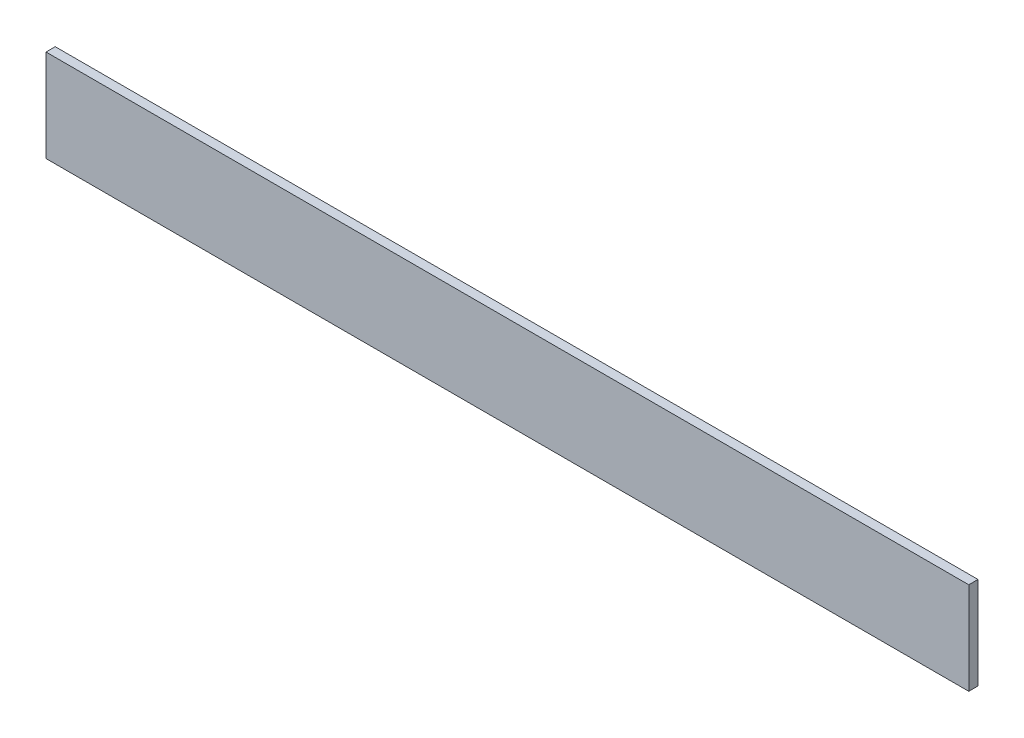
from build123d import *

# Parameters (mm, degrees)
SKETCH1_W           = 500
SKETCH1_H           = 50
BOSS_EXTRUDE1_DEPTH = 5


with BuildPart() as part:
    # Sketch1 → Boss-Extrude1 (new body)
    with BuildSketch(Plane.XY):
        with Locations((51.816239316, 30.822649573)):
            Rectangle(SKETCH1_W, SKETCH1_H)
    extrude(amount=BOSS_EXTRUDE1_DEPTH)


solid = part.part
